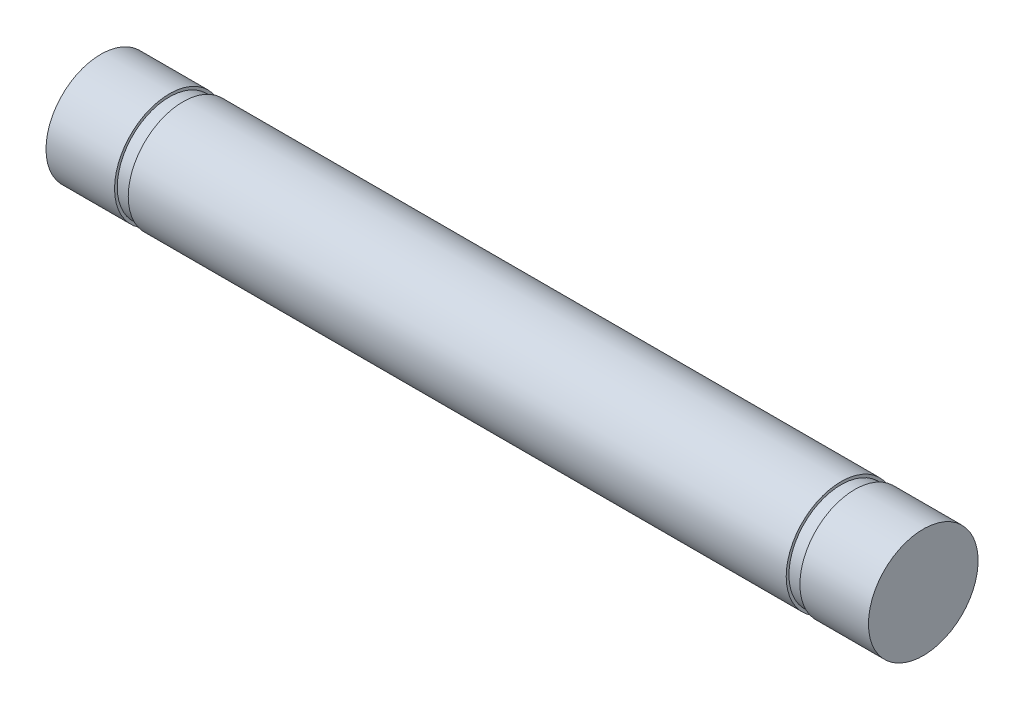
from build123d import *


with BuildPart() as part:
    # Çizim1 → Döndür1 (revolve)
    with BuildSketch(Plane.XY, mode=Mode.PRIVATE) as d_nd_r1_sk:
        Polygon((0, 0), (30, 0), (30, 2), (27.5, 2), (27.5, 1.9), (27, 1.9), (27, 2), (3, 2), (3, 1.9), (2.5, 1.9), (2.5, 2), (0, 2), align=None)
    revolve(d_nd_r1_sk.sketch.rotate(Axis((0, 0, 0), (1, 0, 0)), 90), axis=Axis((0, 0, 0), (1, 0, 0)))


solid = part.part
